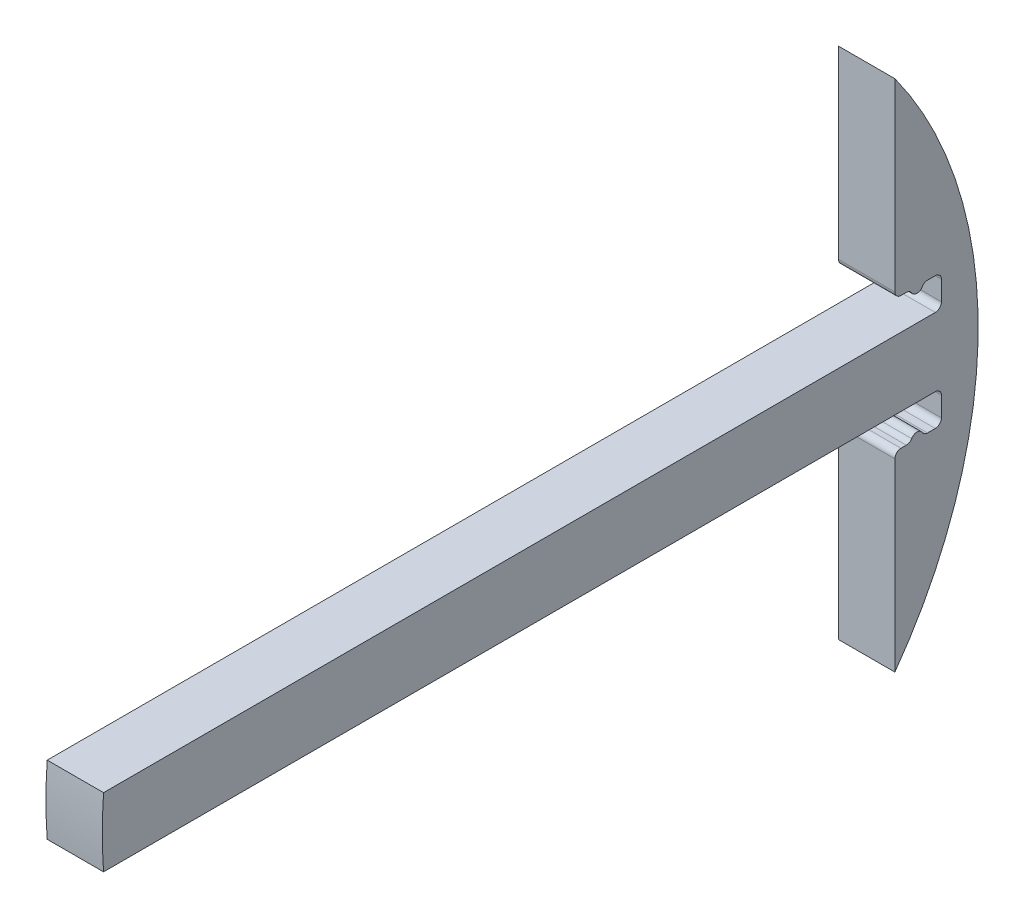
from build123d import *

# Parameters (mm, degrees)
SKETCH1_R           = 35.75
BOSS_EXTRUDE1_DEPTH = 4.6
CUT_EXTRUDE1_DEPTH  = 51.766967607
FILLET1_R           = 0.5
FILLET2_R           = 0.5


with BuildPart() as part:
    # Sketch1 → Boss-Extrude1 (new body)
    with BuildSketch(Plane(origin=(0, 0, 0), x_dir=(0, 0, -1), z_dir=(1, 0, 0))):
        Circle(SKETCH1_R)
    extrude(amount=BOSS_EXTRUDE1_DEPTH)

    # Sketch2 → Cut-Extrude1 (cut, through all)
    with BuildSketch(Plane(origin=(4.6, 0, 0), x_dir=(0, 0, -1), z_dir=(1, 0, 0))):
        with BuildLine():
            Line((28.95, 5.4), (28.95, 20.975223479))
            ThreePointArc((28.95, 20.975223479), (-9.683714035, 34.41348838), (-35.640180976, 2.8))
            Line((-35.640180976, 2.8), (28.95, 2.8))
            Line((28.95, 2.8), (28.95, 5.4))
        make_face()
        with BuildLine():
            ThreePointArc((-35.640180976, -2.8), (-9.683714035, -34.41348838), (28.95, -20.975223479))
            Line((28.95, -20.975223479), (28.95, -5.4))
            Line((28.95, -5.4), (28.95, -2.8))
            Line((28.95, -2.8), (-35.640180976, -2.8))
        make_face()
        with BuildLine():
            Line((28.95, 2.8), (32.75, 2.8))
            Line((32.75, 2.8), (32.75, 5.4))
            Line((32.75, 5.4), (31.25, 5.4))
            ThreePointArc((31.25, 5.4), (30.75, 4.9), (30.25, 5.4))
            Line((30.25, 5.4), (28.95, 5.4))
            Line((28.95, 5.4), (28.95, 2.8))
        make_face()
        with BuildLine():
            Line((32.75, -5.4), (32.75, -2.8))
            Line((32.75, -2.8), (28.95, -2.8))
            Line((28.95, -2.8), (28.95, -5.4))
            Line((28.95, -5.4), (30.25, -5.4))
            ThreePointArc((30.25, -5.4), (30.75, -4.9), (31.25, -5.4))
            Line((31.25, -5.4), (32.75, -5.4))
        make_face()
    extrude(amount=-CUT_EXTRUDE1_DEPTH, mode=Mode.SUBTRACT)

    # Fillet1
    fillet1_edges = [part.edges().sort_by_distance(p)[0] for p in [
        (2.3, 5.4, -28.95),
        (2.3, 5.4, -32.75),
        (2.3, 2.8, -32.75),
        (2.3, -5.4, -28.95),
        (2.3, -2.8, -32.75),
        (2.3, -5.4, -32.75),
    ]]
    fillet(fillet1_edges, radius=FILLET1_R)

    # Fillet2
    fillet2_edges = [part.edges().sort_by_distance(p)[0] for p in [
        (2.3, 5.4, -30.25),
        (2.3, 5.4, -31.25),
        (2.3, -5.4, -31.25),
        (2.3, -5.4, -30.25),
    ]]
    fillet(fillet2_edges, radius=FILLET2_R)


solid = part.part
